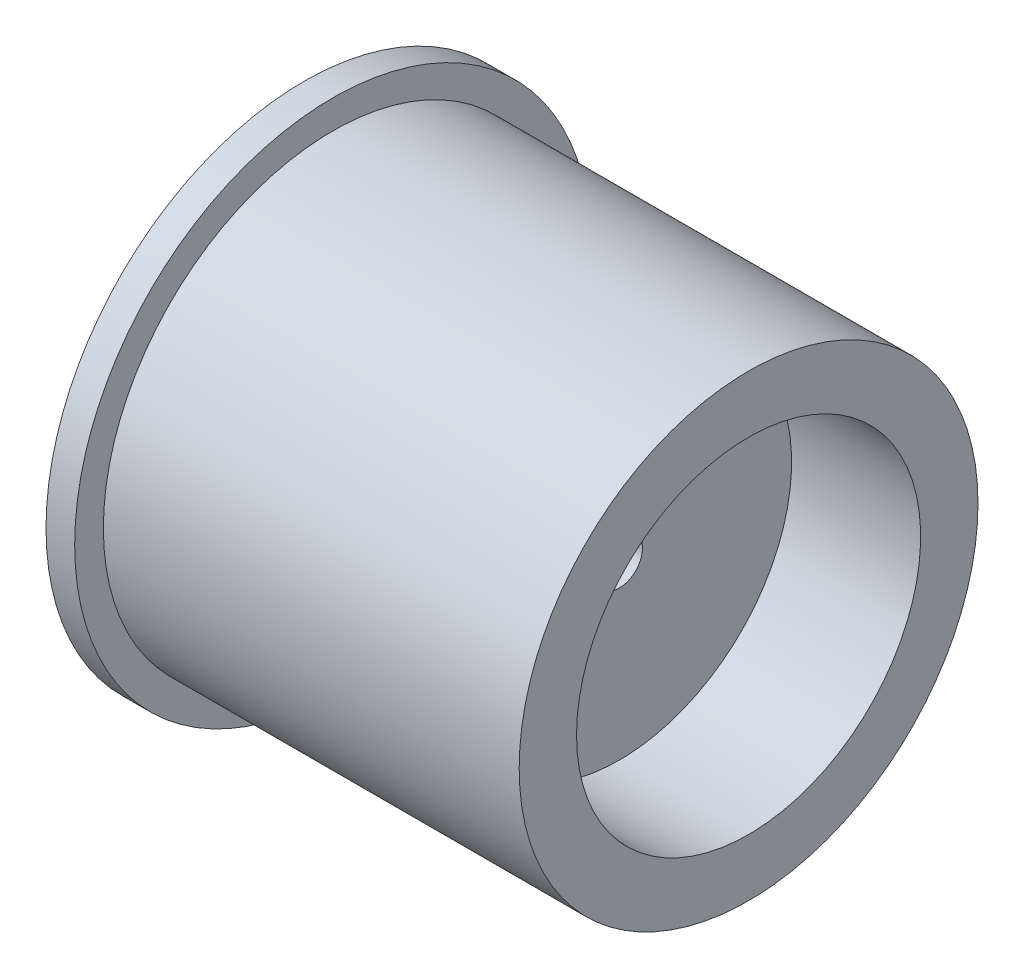
from build123d import *

# Parameters (mm, degrees)
CUT_EXTRUDE1_START = -7
CUT_EXTRUDE1_DEPTH = 6


with BuildPart() as part:
    # Sketch3 → Revolve1 (revolve)
    with BuildSketch(Plane.XY, mode=Mode.PRIVATE) as revolve1_sk:
        Polygon((-7, 1.6), (6, 1.6), (6, 12), (15, 12), (15, 16), (-14, 16), (-14, 18), (-16, 18), (-16, 13), (-7, 13), align=None)
    revolve(revolve1_sk.sketch.rotate(Axis((0, 0, 0), (1, 0, 0)), 90), axis=Axis((0, 0, 0), (1, 0, 0)))

    # Sketch4 → Cut-Extrude1 (cut)
    with BuildSketch(Plane(origin=(0, 0, 0), x_dir=(0, 0, -1), z_dir=(1, 0, 0)).offset(CUT_EXTRUDE1_START)):
        Polygon((3.608439182, 6.25), (-3.608439182, 6.25), (-7.216878365, 0), (-3.608439182, -6.25), (3.608439182, -6.25), (7.216878365, 0), align=None)
    extrude(amount=CUT_EXTRUDE1_DEPTH, mode=Mode.SUBTRACT)


solid = part.part
